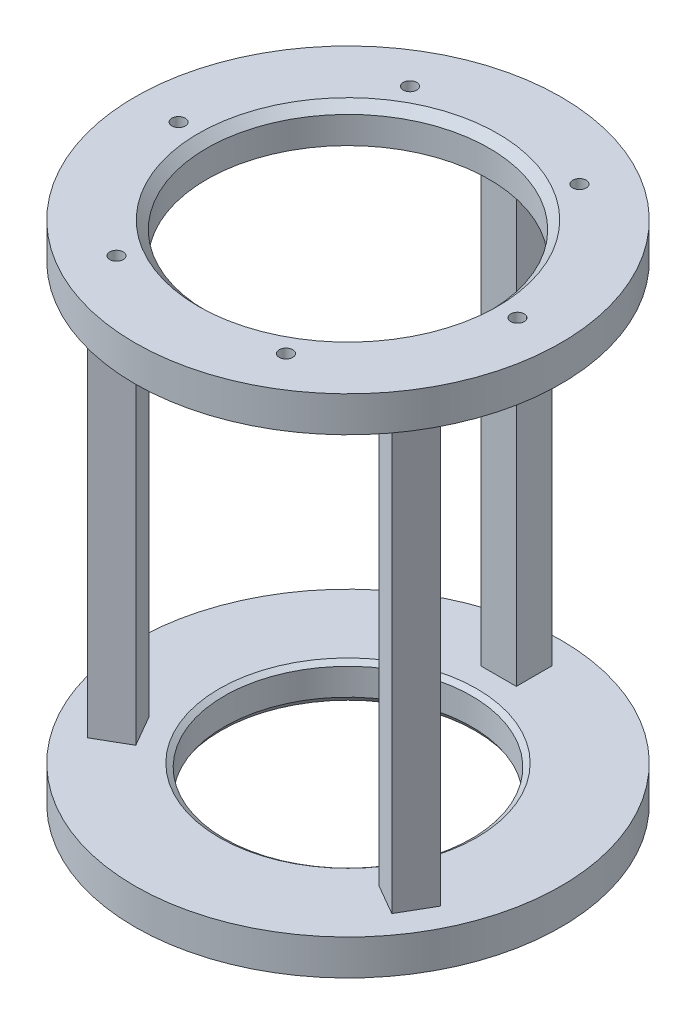
from build123d import *

# Parameters (mm, degrees)
SKETCH1_R             = 76.2
SKETCH1_R_2           = 44.22775
BOSS_EXTRUDE1_DEPTH   = 12.7
SKETCH1_5_W           = 12.7
SKETCH1_5_H           = 12.7
SKETCH1_5_W_2         = 9.398
SKETCH1_5_H_2         = 9.398
BOSS_EXTRUDE2_DEPTH   = 155.575
BOSS_EXTRUDE2_2_DEPTH = 155.575
BOSS_EXTRUDE2_3_DEPTH = 155.575
BOSS_EXTRUDE3_START   = 12.7
SKETCH2_R             = 76.2
SKETCH2_R_2           = 2.413
SKETCH2_R_3           = 50.5206
BOSS_EXTRUDE3_DEPTH   = 12.7
CHAMFER1_SIZE         = 3.0353
CHAMFER2_SIZE         = 1.8542
CHAMFER2_SIZE2        = 1.2827
CHAMFER3_SIZE         = 1.8542
CHAMFER3_SIZE2        = 1.2827


with BuildPart() as part:
    # Sketch1 → Boss-Extrude1 (new body)
    with BuildSketch(Plane(origin=(0, 0, 0), x_dir=(1, 0, 0), z_dir=(0, 1, 0))):
        Circle(SKETCH1_R)
        Circle(SKETCH1_R_2, mode=Mode.SUBTRACT)
    extrude(amount=-BOSS_EXTRUDE1_DEPTH)

    # Chamfer2
    chamfer2_edges = [part.edges().sort_by_distance(p)[0] for p in [
        (-44.22775, 0, 0),
    ]]
    chamfer2_side = [part.faces().sort_by_distance(p)[0] for p in [
        (-74.044738531, 0, 0),
    ]]
    chamfer(chamfer2_edges, length=CHAMFER2_SIZE, length2=CHAMFER2_SIZE2, reference=chamfer2_side[0])

    # Chamfer3
    chamfer3_edges = [part.edges().sort_by_distance(p)[0] for p in [
        (-44.22775, -12.7, 0),
    ]]
    chamfer3_side = [part.faces().sort_by_distance(p)[0] for p in [
        (-44.22775, -6.99135, 0),
    ]]
    chamfer(chamfer3_edges, length=CHAMFER3_SIZE, length2=CHAMFER3_SIZE2, reference=chamfer3_side[0])


with BuildPart() as body_2:
    # Sketch1<5> → Boss-Extrude2 (new body)
    with BuildSketch(Plane(origin=(0, 0, 0), x_dir=(1, 0, 0), z_dir=(0, 1, 0))):
        with Locations((0, 60.213875)):
            Rectangle(SKETCH1_5_W, SKETCH1_5_H)
        with Locations((0, 60.213875)):
            Rectangle(SKETCH1_5_W_2, SKETCH1_5_H_2, mode=Mode.SUBTRACT)
    extrude(amount=BOSS_EXTRUDE2_DEPTH)



with BuildPart() as body_3:
    # Sketch1<5> → Boss-Extrude2 2 (new body)
    with BuildSketch(Plane(origin=(0, 0, 0), x_dir=(1, 0, 0), z_dir=(0, 1, 0))):
        Polygon((60.821006724, -27.782676186), (49.822484096, -21.432676186), (43.472484096, -32.431198814), (54.471006724, -38.781198814), align=None)
        Polygon((45.727792038, -31.826890872), (50.426792038, -23.687984128), (58.565698783, -28.386984128), (53.866698783, -36.525890872), align=None, mode=Mode.SUBTRACT)
    extrude(amount=BOSS_EXTRUDE2_2_DEPTH)


with BuildPart() as body_4:
    # Sketch1<5> → Boss-Extrude2 3 (new body)
    with BuildSketch(Plane(origin=(0, 0, 0), x_dir=(1, 0, 0), z_dir=(0, 1, 0))):
        Polygon((-54.471006724, -38.781198814), (-43.472484096, -32.431198814), (-49.822484096, -21.432676186), (-60.821006724, -27.782676186), align=None)
        Polygon((-50.426792038, -23.687984128), (-45.727792038, -31.826890872), (-53.866698783, -36.525890872), (-58.565698783, -28.386984128), align=None, mode=Mode.SUBTRACT)
    extrude(amount=BOSS_EXTRUDE2_3_DEPTH)


with BuildPart() as body_2_1:
    add(body_2.part)

    add(body_3.part)  # Boss-Extrude3 merges body 3

    add(body_4.part)  # Boss-Extrude3 merges body 4
    # Sketch2 → Boss-Extrude3 (add)
    with BuildSketch(Plane(origin=(0, 155.575, 0), x_dir=(1, 0, 0), z_dir=(0, 1, 0)).offset(BOSS_EXTRUDE3_START)):
        Circle(SKETCH2_R)
        with Locations((30.3054258, -52.490537231)):
            Circle(SKETCH2_R_2, mode=Mode.SUBTRACT)
        with Locations((-30.3054258, 52.490537231)):
            Circle(SKETCH2_R_2, mode=Mode.SUBTRACT)
        with Locations((-60.6108516, 0)):
            Circle(SKETCH2_R_2, mode=Mode.SUBTRACT)
        with Locations((-30.3054258, -52.490537231)):
            Circle(SKETCH2_R_2, mode=Mode.SUBTRACT)
        with Locations((60.6108516, 0)):
            Circle(SKETCH2_R_2, mode=Mode.SUBTRACT)
        with Locations((30.3054258, 52.490537231)):
            Circle(SKETCH2_R_2, mode=Mode.SUBTRACT)
        Circle(SKETCH2_R_3, mode=Mode.SUBTRACT)
    extrude(amount=-BOSS_EXTRUDE3_DEPTH)

    # Chamfer1
    chamfer1_edges = [body_2_1.edges().sort_by_distance(p)[0] for p in [
        (-50.5206, 168.275, 0),
    ]]
    chamfer(chamfer1_edges, length=CHAMFER1_SIZE)


solid = Compound([part.part, body_2_1.part])
